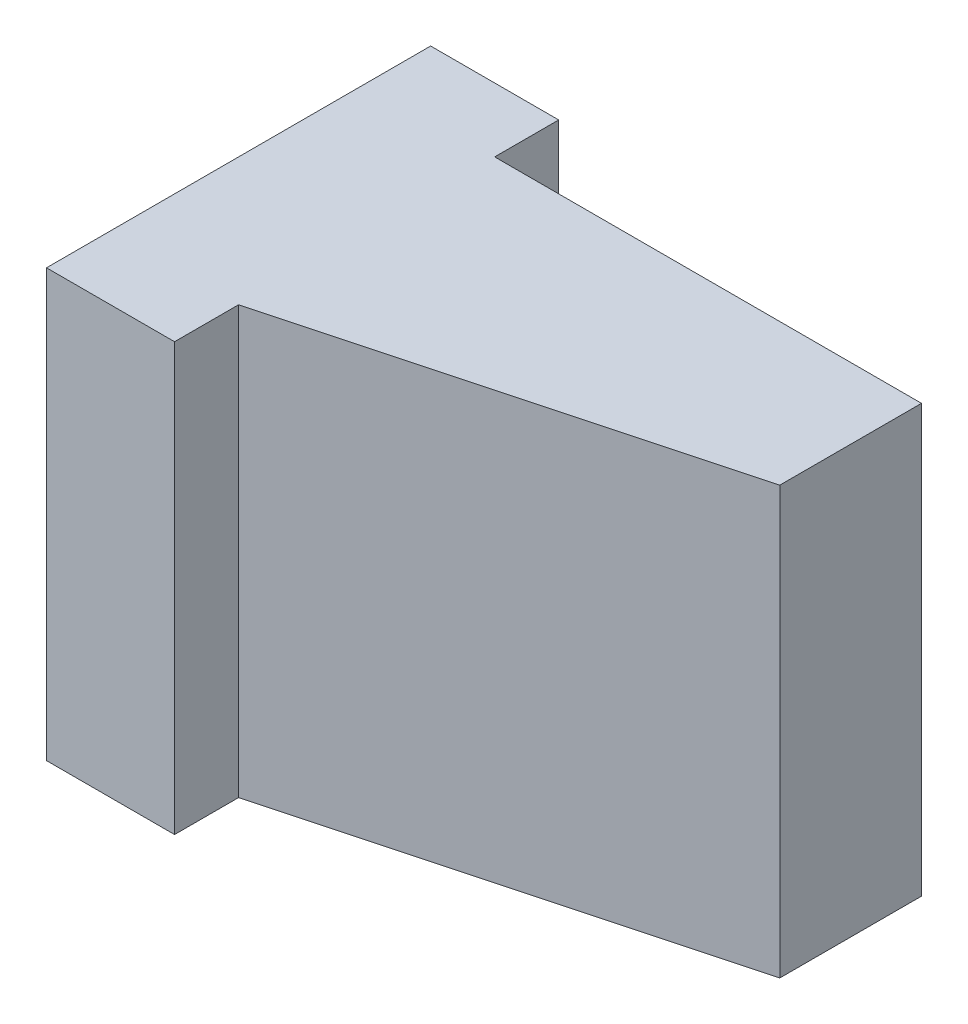
from build123d import *

# Parameters (mm, degrees)
AUFSATZ_LINEAR_AUSTRAGEN1_DEPTH = 10
SKIZZE2_R                       = 1.25
AUFSATZ_LINEAR_AUSTRAGEN2_DEPTH = 2


with BuildPart() as part:
    # Skizze1 → Aufsatz-Linear austragen1 (new body)
    with BuildSketch(Plane(origin=(0, 0, 0), x_dir=(1, 0, 0), z_dir=(0, 1, 0))):
        Polygon((-16.813013293, -2.617875107), (-26.813013293, -5.297367031), (-26.813013293, -6.797367031), (-29.813013293, -6.797367031), (-29.813013293, 2.202632969), (-26.813013293, 2.202632969), (-26.813013293, 0.702632969), (-16.813013293, 0.702632969), align=None)
    extrude(amount=AUFSATZ_LINEAR_AUSTRAGEN1_DEPTH)

    # Skizze2 → Aufsatz-Linear austragen2 (add)
    with BuildSketch(Plane.ZY.offset(29.813013293)):
        with Locations((2.297367031, 5)):
            Circle(SKIZZE2_R)
    extrude(amount=AUFSATZ_LINEAR_AUSTRAGEN2_DEPTH)


solid = part.part
